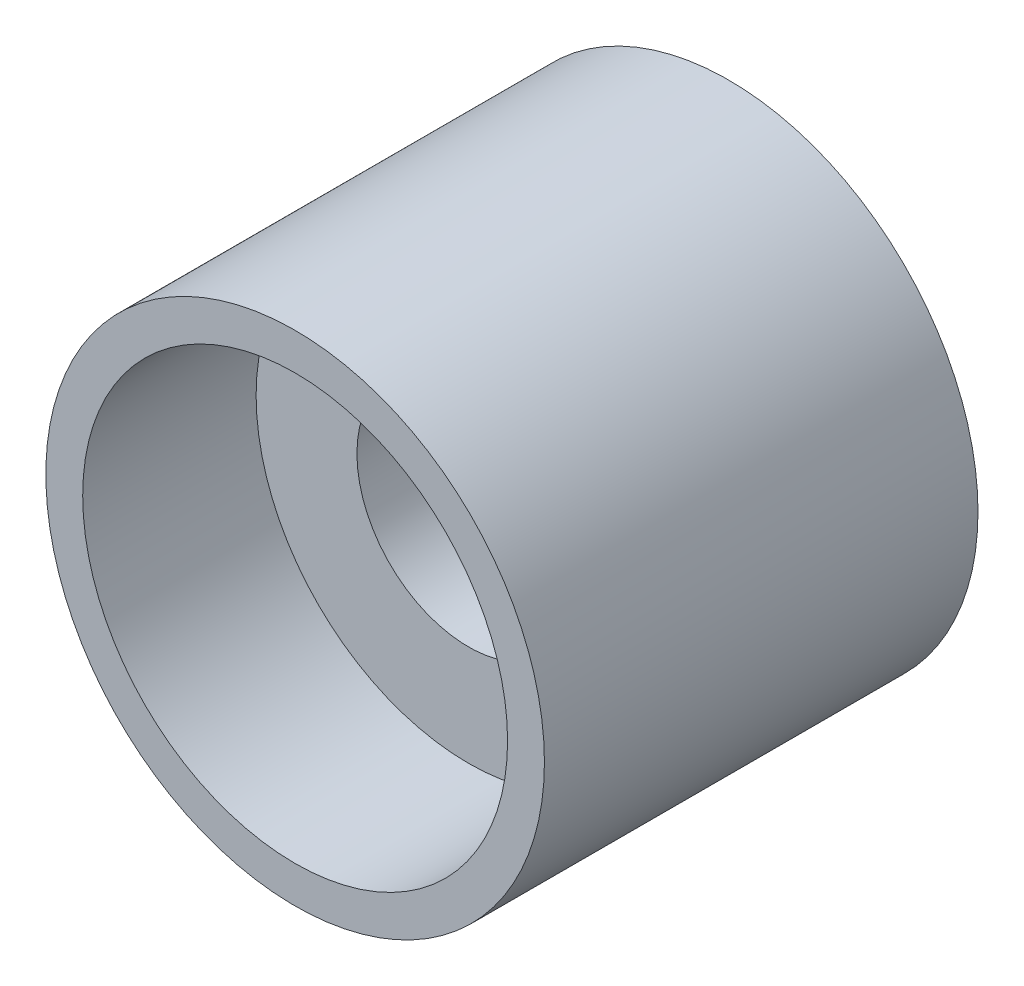
from build123d import *

# Parameters (mm, degrees)
SKETCH1_R           = 11.5
SKETCH1_R_2         = 5.15
BOSS_EXTRUDE1_DEPTH = 20
SKETCH2_R           = 9.8
CUT_EXTRUDE1_DEPTH  = 8


with BuildPart() as part:
    # Sketch1 → Boss-Extrude1 (new body)
    with BuildSketch(Plane.XY):
        Circle(SKETCH1_R)
        Circle(SKETCH1_R_2, mode=Mode.SUBTRACT)
    extrude(amount=BOSS_EXTRUDE1_DEPTH)

    # Sketch2 → Cut-Extrude1 (cut)
    with BuildSketch(Plane.XY.offset(20)):
        Circle(SKETCH2_R)
    extrude(amount=-CUT_EXTRUDE1_DEPTH, mode=Mode.SUBTRACT)


solid = part.part
